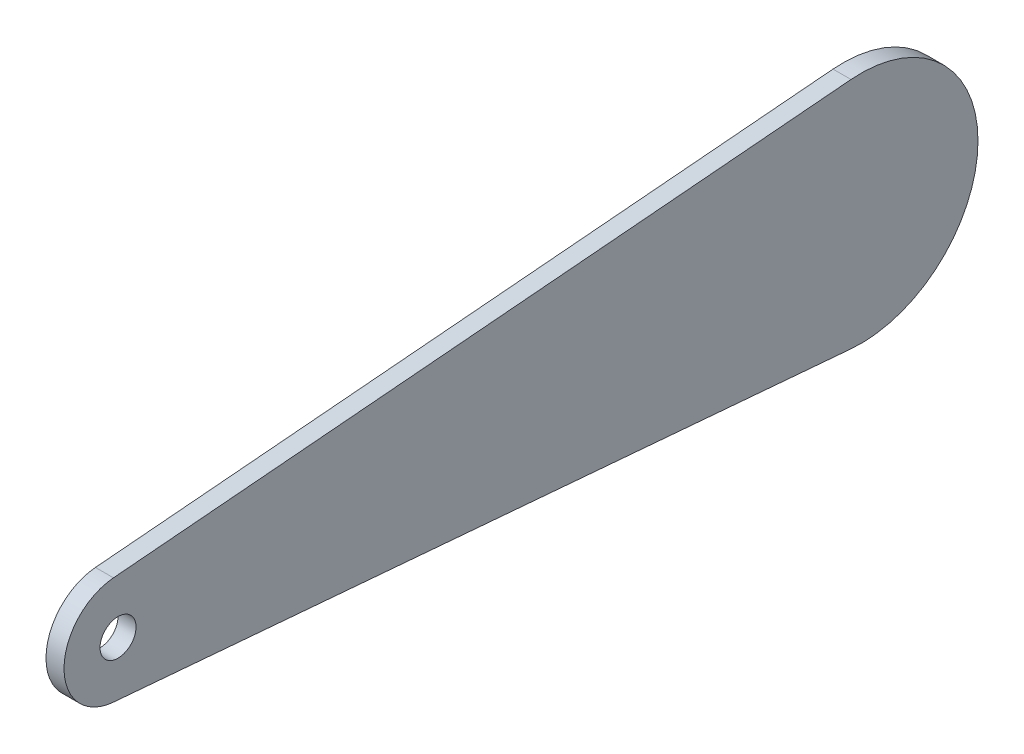
from build123d import *

# Parameters (mm, degrees)
SKETCH1_R           = 10
BOSS_EXTRUDE3_DEPTH = 10


with BuildPart() as part:
    # Sketch1 → Boss-Extrude3 (new body)
    with BuildSketch(Plane(origin=(0, 0, 0), x_dir=(0, 0, -1), z_dir=(1, 0, 0))):
        with BuildLine():
            Line((-208.785201176, 29.891805045), (200.724189368, 64.765577597))
            ThreePointArc((200.724189368, 64.765577597), (271.2396185, 0), (200.724189368, -64.765577597))
            Line((200.724189368, -64.765577597), (-208.785201176, -29.891805045))
            ThreePointArc((-208.785201176, -29.891805045), (-236.2396185, 0), (-208.785201176, 29.891805045))
        make_face()
        with Locations((-206.2396185, 0)):
            Circle(SKETCH1_R, mode=Mode.SUBTRACT)
    extrude(amount=BOSS_EXTRUDE3_DEPTH)


solid = part.part
